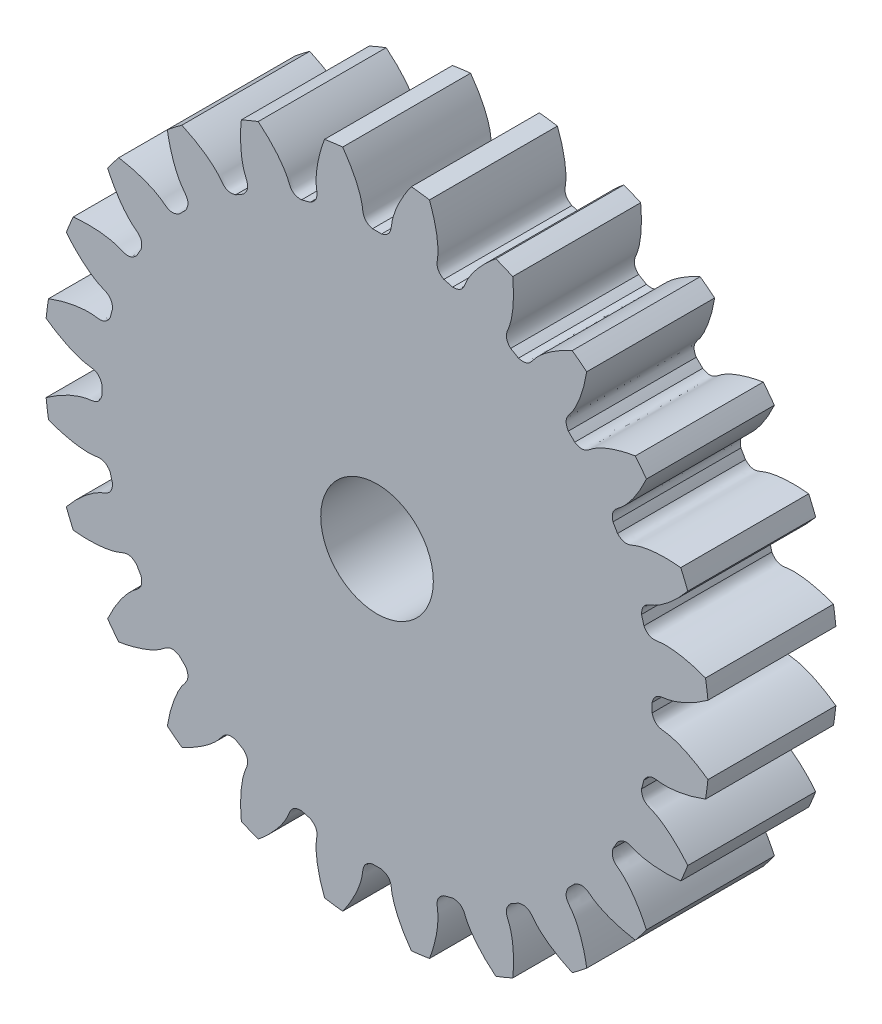
from build123d import *

# Parameters (mm, degrees)
SKETCH_1_R               = 6.5
EXTRUDE_1_DEPTH          = 2.5
CUT_EXTRUDE_1_DEPTH      = 10.526279442
PATTERN_CIRCULAR_1_COUNT = 24
CUT_EXTRUDE_2_REACH      = 11.479
SKETCH_4_R               = 1.1


with BuildPart() as part:
    # 草图1 → 凸台-拉伸1 (new body)
    with BuildSketch(Plane.XY):
        Circle(SKETCH_1_R)
    extrude(amount=EXTRUDE_1_DEPTH)

    # 草图2 → 切除-拉伸1 (cut, through all)
    with BuildSketch(Plane.XY):
        with BuildLine():
            ThreePointArc((0.088415956, 5.374272753), (0, 5.375), (-0.088415956, 5.374272753))
            add(Edge.make_bspline(
                [(-0.088415956, 5.374272753), (-0.283956108, 5.428430036), (-0.269523883, 5.557861799), (-0.293138588, 5.686342226), (-0.296517959, 5.702916521), (-0.300724242, 5.721620073), (-0.305840304, 5.742426358), (-0.311952817, 5.765305336), (-0.319146149, 5.790224685), (-0.327504211, 5.817149434), (-0.337109789, 5.846042111), (-0.348044663, 5.876862729), (-0.360389484, 5.909568827), (-0.374223721, 5.944115495), (-0.389625595, 5.980455405), (-0.406672011, 6.018538843), (-0.425438499, 6.058313744), (-0.445999145, 6.099725726), (-0.468426535, 6.142718129), (-0.492791687, 6.187232054), (-0.519163995, 6.233206399), (-0.547611171, 6.280577906), (-0.57819918, 6.329281201), (-0.610992189, 6.379248841), (-0.64605251, 6.430411359), (-0.68344054, 6.482697309), (-0.723214712, 6.53603332), (-0.765431443, 6.590344144), (-0.810145078, 6.645552705), (-0.857407842, 6.701580158), (-0.907269792, 6.758345935), (-0.959778768, 6.81576781), (-1.014980347, 6.873761948), (-1.0729178, 6.932242967), (-1.133632047, 6.991123994), (-1.197161611, 7.05031673), (-1.263542589, 7.109731505), (-1.332808587, 7.169277345), (-1.430211047, 7.249680778), (-1.505961903, 7.308439159), (-1.55780976, 7.347058965)],
                knots=[0, 0, 0, 0, 0.143961355, 0.149818462, 0.156576662, 0.164235955, 0.172796342, 0.182257821, 0.192620395, 0.203884061, 0.216048821, 0.229114674, 0.24308162, 0.25794966, 0.273718793, 0.290389019, 0.307960339, 0.326432751, 0.345806258, 0.366080857, 0.38725655, 0.409333336, 0.432311215, 0.456190188, 0.480970254, 0.506651413, 0.533233666, 0.560717012, 0.589101451, 0.618386984, 0.64857361, 0.679661329, 0.711650141, 0.744540047, 0.778331046, 0.813023138, 0.848616324, 0.885110603, 0.922505975, 1, 1, 1, 1], degree=3))
            ThreePointArc((-1.55780976, 7.347058965), (0, 7.510395907), (1.55780976, 7.347058965))
            add(Edge.make_bspline(
                [(0.088415956, 5.374272753), (0.283956108, 5.428430036), (0.269523883, 5.557861799), (0.293138588, 5.686342226), (0.296517959, 5.702916521), (0.300724242, 5.721620073), (0.305840304, 5.742426358), (0.311952817, 5.765305336), (0.319146149, 5.790224685), (0.327504211, 5.817149434), (0.337109789, 5.846042111), (0.348044663, 5.876862729), (0.360389484, 5.909568827), (0.374223721, 5.944115495), (0.389625595, 5.980455405), (0.406672011, 6.018538843), (0.425438499, 6.058313744), (0.445999145, 6.099725726), (0.468426535, 6.142718129), (0.492791687, 6.187232054), (0.519163995, 6.233206399), (0.547611171, 6.280577906), (0.57819918, 6.329281201), (0.610992189, 6.379248841), (0.64605251, 6.430411359), (0.68344054, 6.482697309), (0.723214712, 6.53603332), (0.765431443, 6.590344144), (0.810145078, 6.645552705), (0.857407842, 6.701580158), (0.907269792, 6.758345935), (0.959778768, 6.81576781), (1.014980347, 6.873761948), (1.0729178, 6.932242967), (1.133632047, 6.991123994), (1.197161611, 7.05031673), (1.263542589, 7.109731505), (1.332808587, 7.169277345), (1.430211047, 7.249680778), (1.505961903, 7.308439159), (1.55780976, 7.347058965)],
                knots=[0, 0, 0, 0, 0.143961355, 0.149818462, 0.156576662, 0.164235955, 0.172796342, 0.182257821, 0.192620395, 0.203884061, 0.216048821, 0.229114674, 0.24308162, 0.25794966, 0.273718793, 0.290389019, 0.307960339, 0.326432751, 0.345806258, 0.366080857, 0.38725655, 0.409333336, 0.432311215, 0.456190188, 0.480970254, 0.506651413, 0.533233666, 0.560717012, 0.589101451, 0.618386984, 0.64857361, 0.679661329, 0.711650141, 0.744540047, 0.778331046, 0.813023138, 0.848616324, 0.885110603, 0.922505975, 1, 1, 1, 1], degree=3))
        make_face()
    cut_extrude_1 = extrude(amount=CUT_EXTRUDE_1_DEPTH, mode=Mode.SUBTRACT)

    # 阵列(圆周)1: 切除-拉伸1 ×24 about axis
    pattern_circular_1_axis = Axis((0, 0, 2.5), (0, 0, -1))
    for i in range(1, PATTERN_CIRCULAR_1_COUNT):
        add(cut_extrude_1.rotate(pattern_circular_1_axis, i * 360 / PATTERN_CIRCULAR_1_COUNT), mode=Mode.SUBTRACT)

    # 草图4 → 切除-拉伸2 (cut, up to next)
    with BuildSketch(Plane(origin=(0, 0, 0), x_dir=(-1, 0, 0), z_dir=(0, 0, -1)), mode=Mode.PRIVATE) as cut_extrude_2_sk1:
        Circle(SKETCH_4_R)
    cut_extrude_2_tool1 = extrude(cut_extrude_2_sk1.sketch, amount=-CUT_EXTRUDE_2_REACH, mode=Mode.PRIVATE) & part.part
    add(cut_extrude_2_tool1.solids().sort_by_distance((0, 0, 0))[0], mode=Mode.SUBTRACT)


solid = part.part
